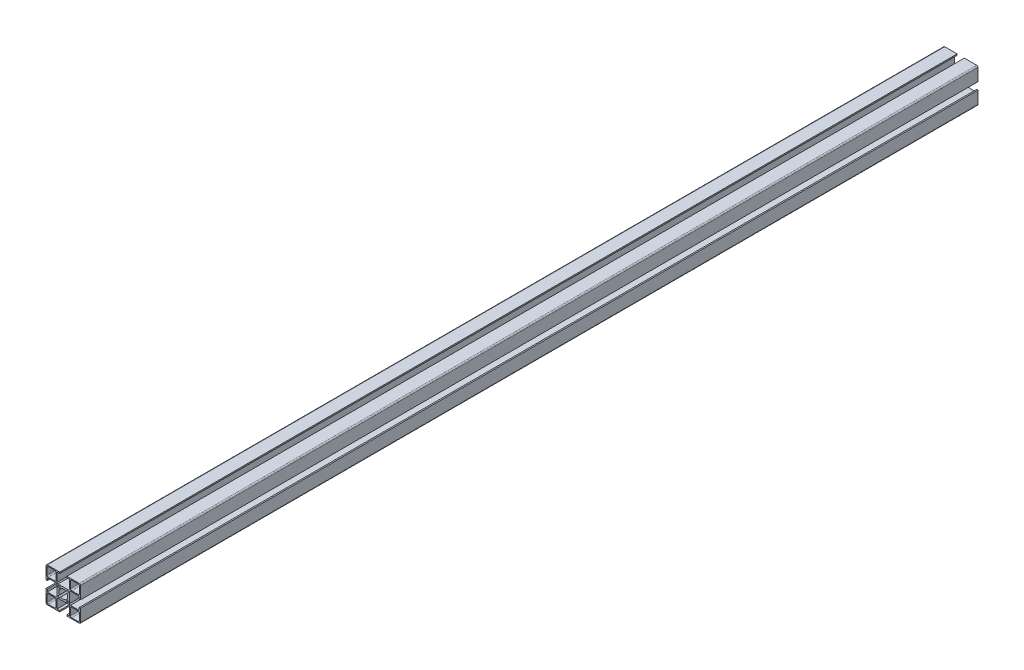
from build123d import *

# Parameters (mm, degrees)
EXTRUDE_1_DEPTH = 1040


with BuildPart() as part:
    # 草图1 → 凸台-拉伸1 (new body)
    with BuildSketch(Plane.XY):
        with BuildLine():
            Line((-6.089339828, -7.15), (6.089339828, -7.15))
            Line((6.089339828, -7.15), (7.15, -8.210660172))
            Line((7.15, -8.210660172), (7.15, -18.5))
            Line((7.15, -18.5), (4.2, -18.5))
            Line((4.2, -18.5), (4.2, -20))
            Line((4.2, -20), (18.5, -20))
            ThreePointArc((18.5, -20), (19.560660172, -19.560660172), (20, -18.5))
            Line((20, -18.5), (20, -4.2))
            Line((20, -4.2), (18.5, -4.2))
            Line((18.5, -4.2), (18.5, -7.15))
            Line((18.5, -7.15), (8.210660172, -7.15))
            Line((8.210660172, -7.15), (7.15, -6.089339828))
            Line((7.15, -6.089339828), (7.15, 6.089339828))
            Line((7.15, 6.089339828), (8.210660172, 7.15))
            Line((8.210660172, 7.15), (18.5, 7.15))
            Line((18.5, 7.15), (18.5, 4.2))
            Line((18.5, 4.2), (20, 4.2))
            Line((20, 4.2), (20, 18.5))
            ThreePointArc((20, 18.5), (19.560660172, 19.560660172), (18.5, 20))
            Line((18.5, 20), (4.2, 20))
            Line((4.2, 20), (4.2, 18.5))
            Line((4.2, 18.5), (7.15, 18.5))
            Line((7.15, 18.5), (7.15, 8.210660172))
            Line((7.15, 8.210660172), (6.089339828, 7.15))
            Line((6.089339828, 7.15), (-6.089339828, 7.15))
            Line((-6.089339828, 7.15), (-7.15, 8.210660172))
            Line((-7.15, 8.210660172), (-7.15, 18.5))
            Line((-7.15, 18.5), (-4.2, 18.5))
            Line((-4.2, 18.5), (-4.2, 20))
            Line((-4.2, 20), (-18.5, 20))
            ThreePointArc((-18.5, 20), (-19.560660172, 19.560660172), (-20, 18.5))
            Line((-20, 18.5), (-20, 4.2))
            Line((-20, 4.2), (-18.5, 4.2))
            Line((-18.5, 4.2), (-18.5, 7.15))
            Line((-18.5, 7.15), (-8.210660172, 7.15))
            Line((-8.210660172, 7.15), (-7.15, 6.089339828))
            Line((-7.15, 6.089339828), (-7.15, -6.089339828))
            Line((-7.15, -6.089339828), (-8.210660172, -7.15))
            Line((-8.210660172, -7.15), (-18.5, -7.15))
            Line((-18.5, -7.15), (-18.5, -4.2))
            Line((-18.5, -4.2), (-20, -4.2))
            Line((-20, -4.2), (-20, -18.5))
            ThreePointArc((-20, -18.5), (-19.560660172, -19.560660172), (-18.5, -20))
            Line((-18.5, -20), (-4.2, -20))
            Line((-4.2, -20), (-4.2, -18.5))
            Line((-4.2, -18.5), (-7.15, -18.5))
            Line((-7.15, -18.5), (-7.15, -8.210660172))
            Line((-7.15, -8.210660172), (-6.089339828, -7.15))
        make_face()
        with BuildLine():
            Line((17.4, 8.25), (9.75, 8.25))
            ThreePointArc((9.75, 8.25), (8.689339828, 8.689339828), (8.25, 9.75))
            Line((8.25, 9.75), (8.25, 17.4))
            ThreePointArc((8.25, 17.4), (8.689339828, 18.460660172), (9.75, 18.9))
            Line((9.75, 18.9), (17.4, 18.9))
            ThreePointArc((17.4, 18.9), (18.460660172, 18.460660172), (18.9, 17.4))
            Line((18.9, 17.4), (18.9, 9.75))
            ThreePointArc((18.9, 9.75), (18.460660172, 8.689339828), (17.4, 8.25))
        make_face(mode=Mode.SUBTRACT)
        with BuildLine():
            Line((-8.25, 17.4), (-8.25, 9.75))
            ThreePointArc((-8.25, 9.75), (-8.689339828, 8.689339828), (-9.75, 8.25))
            Line((-9.75, 8.25), (-17.4, 8.25))
            ThreePointArc((-17.4, 8.25), (-18.460660172, 8.689339828), (-18.9, 9.75))
            Line((-18.9, 9.75), (-18.9, 17.4))
            ThreePointArc((-18.9, 17.4), (-18.460660172, 18.460660172), (-17.4, 18.9))
            Line((-17.4, 18.9), (-9.75, 18.9))
            ThreePointArc((-9.75, 18.9), (-8.689339828, 18.460660172), (-8.25, 17.4))
        make_face(mode=Mode.SUBTRACT)
        with BuildLine():
            Line((-17.4, -8.25), (-9.75, -8.25))
            ThreePointArc((-9.75, -8.25), (-8.689339828, -8.689339828), (-8.25, -9.75))
            Line((-8.25, -9.75), (-8.25, -17.4))
            ThreePointArc((-8.25, -17.4), (-8.689339828, -18.460660172), (-9.75, -18.9))
            Line((-9.75, -18.9), (-17.4, -18.9))
            ThreePointArc((-17.4, -18.9), (-18.460660172, -18.460660172), (-18.9, -17.4))
            Line((-18.9, -17.4), (-18.9, -9.75))
            ThreePointArc((-18.9, -9.75), (-18.460660172, -8.689339828), (-17.4, -8.25))
        make_face(mode=Mode.SUBTRACT)
        with BuildLine():
            Line((8.25, -17.4), (8.25, -9.75))
            ThreePointArc((8.25, -9.75), (8.689339828, -8.689339828), (9.75, -8.25))
            Line((9.75, -8.25), (17.4, -8.25))
            ThreePointArc((17.4, -8.25), (18.460660172, -8.689339828), (18.9, -9.75))
            Line((18.9, -9.75), (18.9, -17.4))
            ThreePointArc((18.9, -17.4), (18.460660172, -18.460660172), (17.4, -18.9))
            Line((17.4, -18.9), (9.75, -18.9))
            ThreePointArc((9.75, -18.9), (8.689339828, -18.460660172), (8.25, -17.4))
        make_face(mode=Mode.SUBTRACT)
        with BuildLine():
            Line((-4.243347723, 2.829134161), (-5.656854249, 4.242640687))
            ThreePointArc((-5.656854249, 4.242640687), (-5.656854249, 5.656854249), (-4.242640687, 5.656854249))
            Line((-4.242640687, 5.656854249), (-2.829134161, 4.243347723))
            ThreePointArc((-2.829134161, 4.243347723), (0, 5.1), (2.829134161, 4.243347723))
            Line((2.829134161, 4.243347723), (4.242640687, 5.656854249))
            ThreePointArc((4.242640687, 5.656854249), (5.656854249, 5.656854249), (5.656854249, 4.242640687))
            Line((5.656854249, 4.242640687), (4.243347723, 2.829134161))
            ThreePointArc((4.243347723, 2.829134161), (5.1, 0), (4.243347723, -2.829134161))
            Line((4.243347723, -2.829134161), (5.656854249, -4.242640687))
            ThreePointArc((5.656854249, -4.242640687), (5.656854249, -5.656854249), (4.242640687, -5.656854249))
            Line((4.242640687, -5.656854249), (2.829134161, -4.243347723))
            ThreePointArc((2.829134161, -4.243347723), (0, -5.1), (-2.829134161, -4.243347723))
            Line((-2.829134161, -4.243347723), (-4.242640687, -5.656854249))
            ThreePointArc((-4.242640687, -5.656854249), (-5.656854249, -5.656854249), (-5.656854249, -4.242640687))
            Line((-5.656854249, -4.242640687), (-4.243347723, -2.829134161))
            ThreePointArc((-4.243347723, -2.829134161), (-5.1, 0), (-4.243347723, 2.829134161))
        make_face(mode=Mode.SUBTRACT)
    extrude(amount=EXTRUDE_1_DEPTH)


solid = part.part
